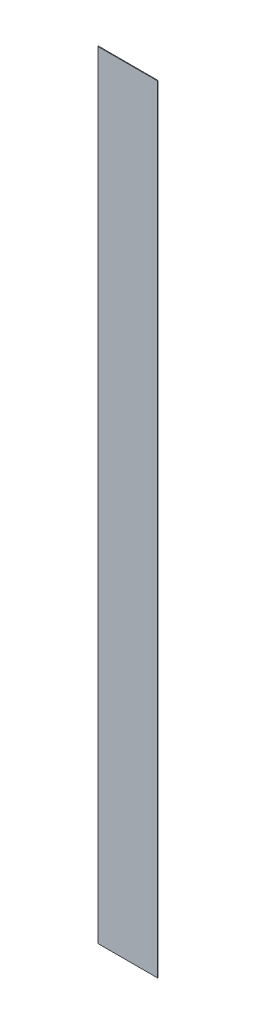
from build123d import *

# Parameters (mm, degrees)
SKETCH_1_W      = 486
SKETCH_1_H      = 6308
EXTRUDE_1_DEPTH = 5


with BuildPart() as part:
    # 草图1 → 凸台-拉伸1 (new body)
    with BuildSketch(Plane.XY):
        Rectangle(SKETCH_1_W, SKETCH_1_H)
    extrude(amount=EXTRUDE_1_DEPTH)


solid = part.part
